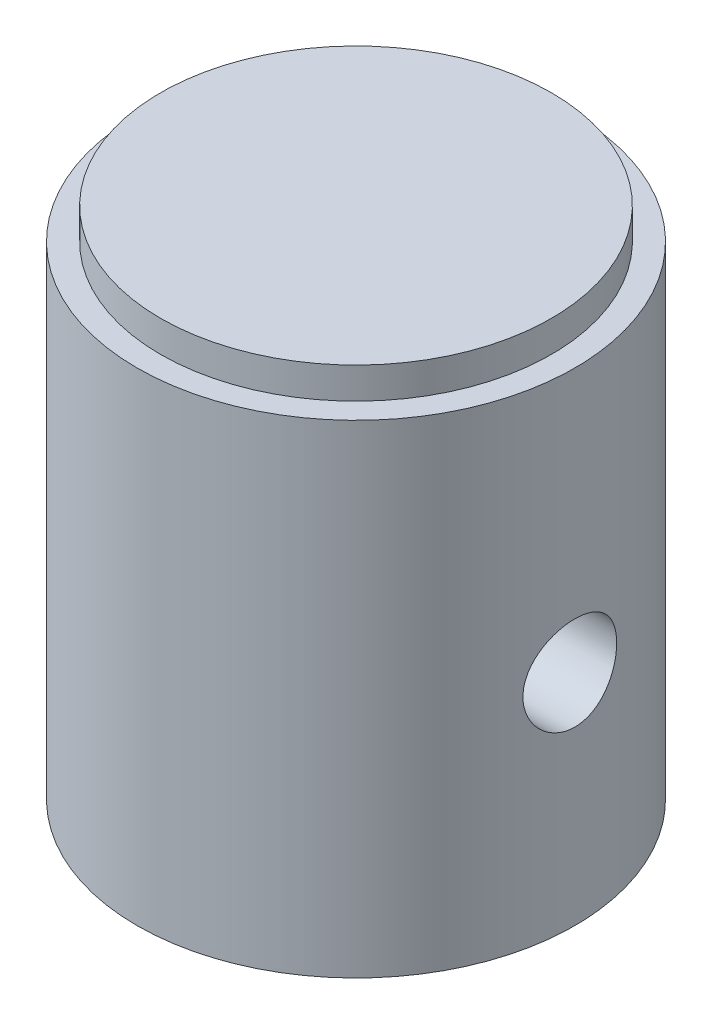
from build123d import *

# Parameters (mm, degrees)
CUT_EXTRUDE1_DEPTH      = 20.195683783
CUT_EXTRUDE1_DEPTH_BACK = 20.195683783
SKETCH2_R               = 1.5


with BuildPart() as part:
    # Sketch1 → Revolve1 (revolve)
    with BuildSketch(Plane.XY, mode=Mode.PRIVATE) as revolve1_sk:
        Polygon((0, 0), (-6.25, 0), (-6.25, -1), (-7, -1), (-7, -16.446102149), (-6.2, -16.446102149), (-4.25, -11.088521181), (-4.25, -5.446102149), (0, -2.892444518), align=None)
    revolve(revolve1_sk.sketch.rotate(Axis((0, 0, 0), (0, -1, 0)), 270), axis=Axis((0, 0, 0), (0, -1, 0)))

    # Sketch2 → Cut-Extrude1 (cut, two sides: drawn at the far end of the back side and taken through both)
    with BuildSketch(Plane(origin=(0, 0, 0), x_dir=(0, 0, -1), z_dir=(1, 0, 0)).offset(-CUT_EXTRUDE1_DEPTH_BACK)):
        with Locations((0, -9.446102149)):
            Circle(SKETCH2_R)
    extrude(amount=CUT_EXTRUDE1_DEPTH + CUT_EXTRUDE1_DEPTH_BACK, mode=Mode.SUBTRACT)


solid = part.part
